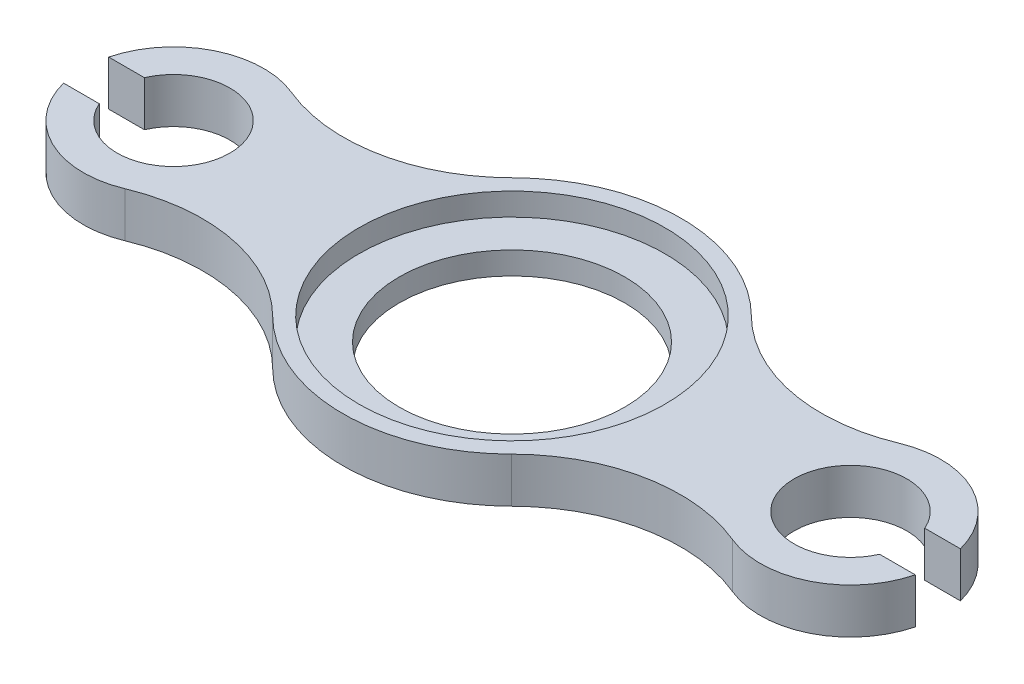
from build123d import *

# Parameters (mm, degrees)
SKETCH1_R           = 67.8
BOSS_EXTRUDE1_DEPTH = 20
SKETCH1_3_R         = 67.8
SKETCH1_3_R_2       = 50
BOSS_EXTRUDE2_DEPTH = 10


with BuildPart() as part:
    # Sketch1 → Boss-Extrude1 (new body)
    with BuildSketch(Plane(origin=(0, 0, 0), x_dir=(1, 0, 0), z_dir=(0, 1, 0))):
        with BuildLine():
            ThreePointArc((-172.912878475, 10), (-125, 0), (-172.912878475, -10))
            Line((-172.912878475, -10), (-188.729833462, -10))
            ThreePointArc((-188.729833462, -10), (-167.842344673, -35.800149952), (-134.666666667, -36.944402673))
            ThreePointArc((-134.666666667, -36.944402673), (-91.362529225, -32.640861336), (-52.958333333, -53.107578843))
            ThreePointArc((-52.958333333, -53.107578843), (0, -75), (52.958333333, -53.107578843))
            ThreePointArc((52.958333333, -53.107578843), (91.362529225, -32.640861336), (134.666666667, -36.944402673))
            ThreePointArc((134.666666667, -36.944402673), (167.842344673, -35.800149952), (188.729833462, -10))
            Line((188.729833462, -10), (172.912878475, -10))
            ThreePointArc((172.912878475, -10), (125, 0), (172.912878475, 10))
            Line((172.912878475, 10), (188.729833462, 10))
            ThreePointArc((188.729833462, 10), (167.842344673, 35.800149952), (134.666666667, 36.944402673))
            ThreePointArc((134.666666667, 36.944402673), (91.362529225, 32.640861336), (52.958333333, 53.107578843))
            ThreePointArc((52.958333333, 53.107578843), (0, 75), (-52.958333333, 53.107578843))
            ThreePointArc((-52.958333333, 53.107578843), (-91.362529225, 32.640861336), (-134.666666667, 36.944402673))
            ThreePointArc((-134.666666667, 36.944402673), (-167.842344673, 35.800149952), (-188.729833462, 10))
            Line((-188.729833462, 10), (-172.912878475, 10))
        make_face()
        Circle(SKETCH1_R, mode=Mode.SUBTRACT)
    extrude(amount=BOSS_EXTRUDE1_DEPTH)

    # Sketch1<3> → Boss-Extrude2 (add)
    with BuildSketch(Plane(origin=(0, 0, 0), x_dir=(1, 0, 0), z_dir=(0, 1, 0))):
        Circle(SKETCH1_3_R)
        Circle(SKETCH1_3_R_2, mode=Mode.SUBTRACT)
    extrude(amount=BOSS_EXTRUDE2_DEPTH)


solid = part.part
